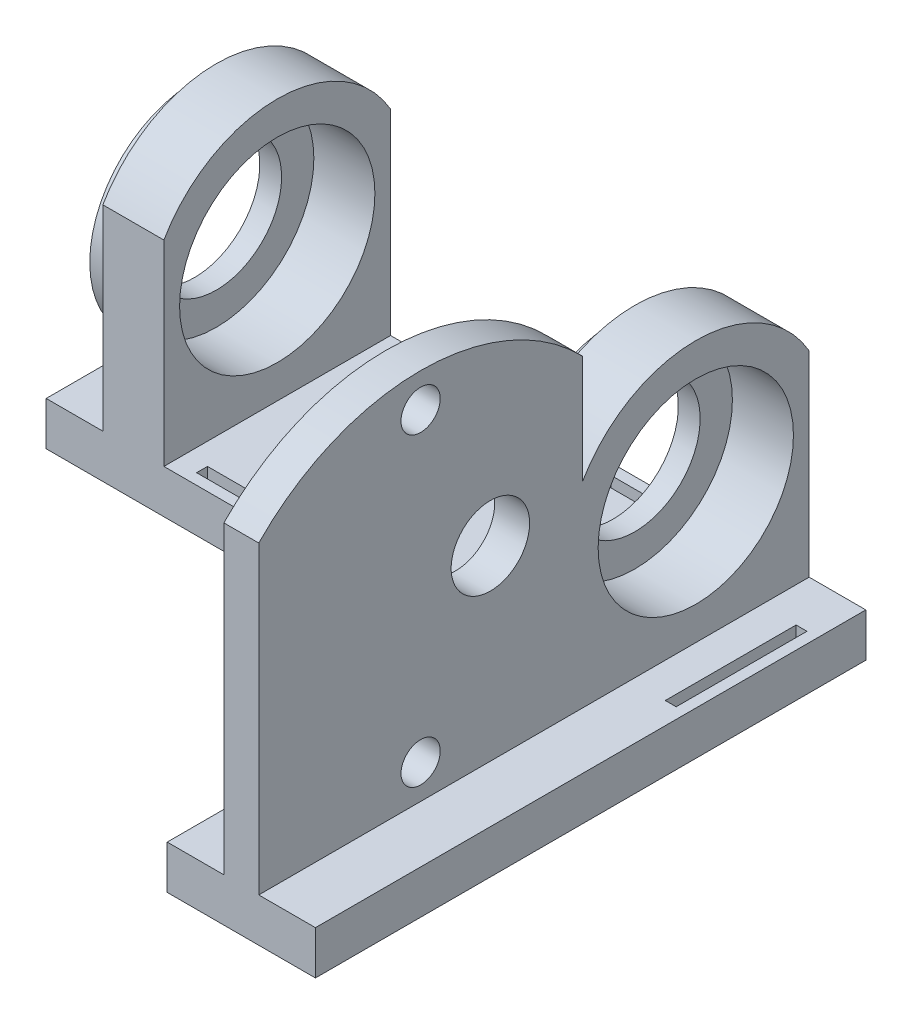
from build123d import *

# Parameters (mm, degrees)
SKETCH1_W            = 20
SKETCH1_H            = 26
SKETCH1_W_2          = 1.25
SKETCH1_H_2          = 15
BOSS_EXTRUDE5_DEPTH  = 5
SKETCH3_W            = 7
SKETCH3_H            = 26
BOSS_EXTRUDE6_DEPTH  = 40
CUT_EXTRUDE1_REACH   = 55.696
SKETCH5_R            = 11.2
SKETCH6_W            = 26
SKETCH6_H            = 5
BOSS_EXTRUDE8_DEPTH  = 14
SKETCH8_R            = 12
SKETCH8_R_2          = 7.5
BOSS_EXTRUDE9_DEPTH  = 2.5
SKETCH9_R            = 12
SKETCH9_R_2          = 7.5
BOSS_EXTRUDE10_DEPTH = 2.5
SKETCH7_W            = 12
SKETCH7_H            = 1.25
CUT_EXTRUDE2_DEPTH   = 10
BOSS_EXTRUDE11_DEPTH = 37.12
SKETCH14_R           = 2.25
SKETCH14_R_2         = 4.5
CUT_EXTRUDE4_DEPTH   = 10


with BuildPart() as part:
    # Sketch1 → Boss-Extrude5 (new body)
    with BuildSketch(Plane(origin=(0, 0, 0), x_dir=(1, 0, 0), z_dir=(0, 1, 0))):
        with Locations((10, 13)):
            Rectangle(SKETCH1_W, SKETCH1_H)
        with Locations((1.875, 13)):
            Rectangle(SKETCH1_W_2, SKETCH1_H_2, mode=Mode.SUBTRACT)
    boss_extrude5 = extrude(amount=BOSS_EXTRUDE5_DEPTH)

    # Sketch3 → Boss-Extrude6 (add)
    with BuildSketch(Plane(origin=(0, 5, 0), x_dir=(1, 0, 0), z_dir=(0, 1, 0))):
        with Locations((10, 13)):
            Rectangle(SKETCH3_W, SKETCH3_H)
    boss_extrude6 = extrude(amount=BOSS_EXTRUDE6_DEPTH)

    # Sketch5 → Cut-Extrude1 (cut, up to next)
    with BuildSketch(Plane(origin=(13.5, 0, 0), x_dir=(0, 0, -1), z_dir=(1, 0, 0)), mode=Mode.PRIVATE) as cut_extrude1_sk1:
        with Locations((13, 20)):
            Circle(SKETCH5_R)
    cut_extrude1_tool1 = extrude(cut_extrude1_sk1.sketch, amount=-CUT_EXTRUDE1_REACH, mode=Mode.PRIVATE) & part.part
    # Sketch5 → Cut-Extrude1 (cut, up to next)
    with BuildSketch(Plane(origin=(13.5, 0, 0), x_dir=(0, 0, -1), z_dir=(1, 0, 0)), mode=Mode.PRIVATE) as cut_extrude1_sk2:
        with BuildLine():
            Line((0, 27.483314774), (0, 45))
            Line((0, 45), (26, 45))
            Line((26, 45), (26, 27.483314774))
            ThreePointArc((26, 27.483314774), (13, 35), (0, 27.483314774))
        make_face()
    cut_extrude1_tool2 = extrude(cut_extrude1_sk2.sketch, amount=-CUT_EXTRUDE1_REACH, mode=Mode.PRIVATE) & part.part
    cut_extrude1_1 = cut_extrude1_tool1.solids().sort_by_distance((13.5, 20, -13))[0]
    add(cut_extrude1_1, mode=Mode.SUBTRACT)
    cut_extrude1_2 = cut_extrude1_tool2.solids().sort_by_distance((13.5, 38.725293, -13))[0]
    add(cut_extrude1_2, mode=Mode.SUBTRACT)
    cut_extrude1 = cut_extrude1_1 + cut_extrude1_2  # Cut-Extrude1 as one shape, for the pattern or mirror that repeats it

    # Sketch6 → Boss-Extrude8 (add)
    with BuildSketch(Plane(origin=(20, 0, 0), x_dir=(0, 0, -1), z_dir=(1, 0, 0))):
        with Locations((13, 2.5)):
            Rectangle(SKETCH6_W, SKETCH6_H)
    boss_extrude8 = extrude(amount=BOSS_EXTRUDE8_DEPTH)

    # Mirror5: Boss-Extrude5, Boss-Extrude6, Cut-Extrude1, Boss-Extrude8 across plane
    add(boss_extrude5.mirror(Plane.ZY.offset(-34)))
    add(boss_extrude6.mirror(Plane.ZY.offset(-34)))
    add(cut_extrude1.mirror(Plane.ZY.offset(-34)), mode=Mode.SUBTRACT)
    add(boss_extrude8.mirror(Plane.ZY.offset(-34)))

    # Sketch8 → Boss-Extrude9 (add)
    with BuildSketch(Plane.ZY.offset(-6.5)):
        with Locations(Location((-13, 20, 0), (0, 0, 180))):
            Circle(SKETCH8_R)
        with Locations((-13, 20)):
            Circle(SKETCH8_R_2, mode=Mode.SUBTRACT)
    extrude(amount=BOSS_EXTRUDE9_DEPTH)

    # Sketch9 → Boss-Extrude10 (add)
    with BuildSketch(Plane.ZY.offset(-54.5)):
        with Locations(Location((-13, 20, 0), (0, 0, 180))):
            Circle(SKETCH9_R)
        with Locations((-13, 20)):
            Circle(SKETCH9_R_2, mode=Mode.SUBTRACT)
    extrude(amount=BOSS_EXTRUDE10_DEPTH)

    # Sketch7 → Cut-Extrude2 (cut)
    with BuildSketch(Plane(origin=(0, 5, 0), x_dir=(1, 0, 0), z_dir=(0, 1, 0))):
        with Locations((22, 1.875)):
            Rectangle(SKETCH7_W, SKETCH7_H)
        with Locations((46, 1.875)):
            Rectangle(SKETCH7_W, SKETCH7_H)
        with Locations((46, 24.125)):
            Rectangle(SKETCH7_W, SKETCH7_H)
        with Locations((22, 24.125)):
            Rectangle(SKETCH7_W, SKETCH7_H)
    extrude(amount=-CUT_EXTRUDE2_DEPTH, mode=Mode.SUBTRACT)

    # Sketch10 → Boss-Extrude11 (add)
    with BuildSketch(Plane.XY):
        Polygon((51, 0), (68, 0), (68, 5), (61.5, 5), (61.5, 47.8), (57.5, 47.8), (57.5, 5), (51, 5), align=None)
    extrude(amount=BOSS_EXTRUDE11_DEPTH)

    # Sketch14 → Cut-Extrude4 (cut)
    with BuildSketch(Plane(origin=(61.5, 0, 0), x_dir=(0, 0, -1), z_dir=(1, 0, 0))):
        Polygon((-37.12, 51.83243557), (-37.12, 47.8), (-18.56, 47.8), (0, 47.8), (0, 51.83243557), align=None)
        with BuildLine():
            Line((0, 47.8), (-18.56, 47.8))
            ThreePointArc((-18.56, 47.8), (-8.484558377, 45.75747818), (0, 39.952421039))
            Line((0, 39.952421039), (0, 47.8))
        make_face()
        with BuildLine():
            Line((-37.12, 47.8), (-37.12, 39.952421039))
            ThreePointArc((-37.12, 39.952421039), (-28.635441623, 45.75747818), (-18.56, 47.8))
            Line((-18.56, 47.8), (-37.12, 47.8))
        make_face()
        with Locations((-18.556883399, 43.896979327)):
            Circle(SKETCH14_R)
        with Locations((-10.556883399, 26.396979327)):
            Circle(SKETCH14_R_2)
        with Locations((-18.556883399, 8.896979327)):
            Circle(SKETCH14_R)
    extrude(amount=-CUT_EXTRUDE4_DEPTH, mode=Mode.SUBTRACT)


solid = part.part
